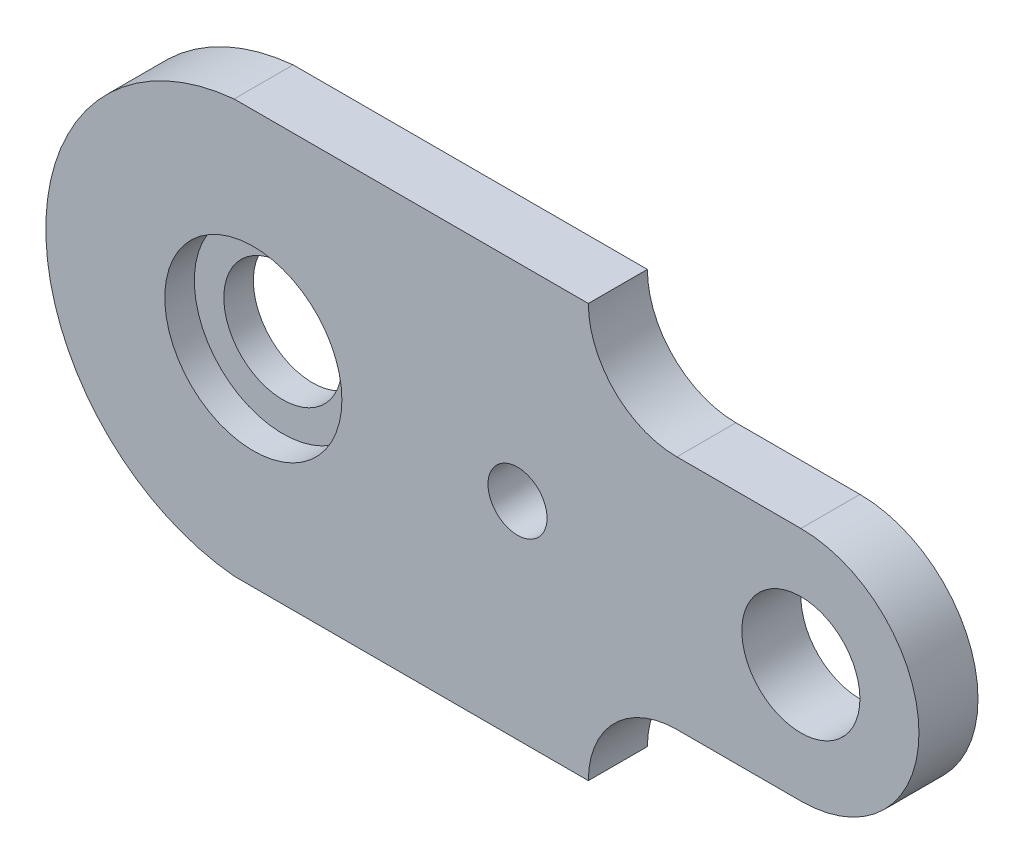
from build123d import *

# Parameters (mm, degrees)
SKETCH2_R           = 10
SKETCH2_R_2         = 5
BOSS_EXTRUDE3_DEPTH = 10
SKETCH3_R           = 15
CUT_EXTRUDE1_DEPTH  = 5
SKETCH4_R           = 10
CUT_EXTRUDE2_DEPTH  = 259.488315973


with BuildPart() as part:
    # Sketch2 → Boss-Extrude3 (new body)
    with BuildSketch(Plane.XY):
        with BuildLine():
            Line((-207.050381934, 98.472297517), (-147.050381934, 98.472297517))
            ThreePointArc((-147.050381934, 98.472297517), (-142.656983652, 87.865695799), (-132.050381934, 83.472297517))
            Line((-132.050381934, 83.472297517), (-111.050381934, 83.472297517))
            ThreePointArc((-111.050381934, 83.472297517), (-91.050381934, 63.472297517), (-111.050381934, 43.472297517))
            Line((-111.050381934, 43.472297517), (-132.050406277, 43.472297517))
            ThreePointArc((-132.050406277, 43.472297517), (-142.656990782, 39.078906365), (-147.050381934, 28.47232186))
            Line((-147.050381934, 28.47232186), (-207.050381934, 28.47232186))
            ThreePointArc((-207.050381934, 28.47232186), (-238.944378708, 63.472309688), (-207.050381934, 98.472297517))
        make_face()
        with Locations((-111.050381934, 63.472297517)):
            Circle(SKETCH2_R, mode=Mode.SUBTRACT)
        with Locations((-159.050381934, 63.472309688)):
            Circle(SKETCH2_R_2, mode=Mode.SUBTRACT)
    extrude(amount=BOSS_EXTRUDE3_DEPTH)

    # Sketch3 → Cut-Extrude1 (cut)
    with BuildSketch(Plane.XY.offset(10)):
        with Locations((-203.793152693, 63.472309688)):
            Circle(SKETCH3_R)
    extrude(amount=-CUT_EXTRUDE1_DEPTH, mode=Mode.SUBTRACT)

    # Sketch4 → Cut-Extrude2 (cut, through all)
    with BuildSketch(Plane.XY.offset(5)):
        with Locations((-203.793152693, 63.472309688)):
            Circle(SKETCH4_R)
    extrude(amount=-CUT_EXTRUDE2_DEPTH, mode=Mode.SUBTRACT)


solid = part.part
